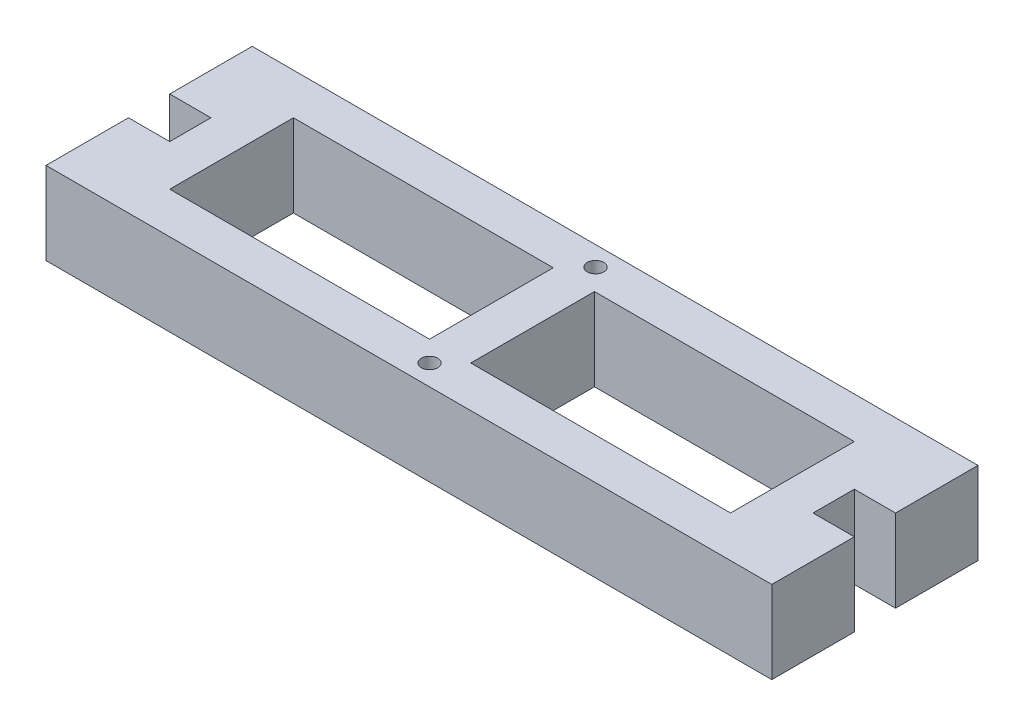
from build123d import *

# Parameters (mm, degrees)
SKETCH1_W           = 98
SKETCH1_H           = 25
BOSS_EXTRUDE1_DEPTH = 10
CUT_EXTRUDE4_DEPTH  = 10
SKETCH4_W           = 25
SKETCH4_H           = 10
CUT_EXTRUDE6_DEPTH  = 5
SKETCH5_W           = 25
SKETCH5_H           = 10
CUT_EXTRUDE7_DEPTH  = 5
SKETCH6_W           = 5
SKETCH6_H           = 10
CUT_EXTRUDE8_DEPTH  = 5
SKETCH7_W           = 5
SKETCH7_H           = 10
CUT_EXTRUDE9_DEPTH  = 5
CUT_EXTRUDE10_DEPTH = 1.5
SKETCH9_R           = 1
CUT_EXTRUDE11_DEPTH = 11.5
SKETCH10_R          = 1
CUT_EXTRUDE12_DEPTH = 19.5
SKETCH11_R          = 1.75
CUT_EXTRUDE13_DEPTH = 1.5


with BuildPart() as part:
    # Sketch1 → Boss-Extrude1 (new body)
    with BuildSketch(Plane(origin=(0, 0, 0), x_dir=(1, 0, 0), z_dir=(0, 1, 0))):
        Rectangle(SKETCH1_W, SKETCH1_H)
    extrude(amount=BOSS_EXTRUDE1_DEPTH)

    # Sketch2 → Cut-Extrude4 (cut)
    with BuildSketch(Plane(origin=(0, 10, 0), x_dir=(1, 0, 0), z_dir=(0, 1, 0))):
        Polygon((-2.5, 2.403992328), (-2.5, -7.5), (-34, -7.5), (-34, 7.5), (-2.5, 7.5), align=None)
        Polygon((2.5, 2.403992328), (2.5, 7.5), (34, 7.5), (34, -7.5), (2.5, -7.5), align=None)
    extrude(amount=-CUT_EXTRUDE4_DEPTH, mode=Mode.SUBTRACT)

    # Sketch4 → Cut-Extrude6 (cut)
    with BuildSketch(Plane.ZY.offset(49)):
        with Locations((0, 5)):
            Rectangle(SKETCH4_W, SKETCH4_H)
    extrude(amount=-CUT_EXTRUDE6_DEPTH, mode=Mode.SUBTRACT)

    # Sketch5 → Cut-Extrude7 (cut)
    with BuildSketch(Plane(origin=(49, 0, 0), x_dir=(0, 0, -1), z_dir=(1, 0, 0))):
        with Locations((0, 5)):
            Rectangle(SKETCH5_W, SKETCH5_H)
    extrude(amount=-CUT_EXTRUDE7_DEPTH, mode=Mode.SUBTRACT)

    # Sketch6 → Cut-Extrude8 (cut)
    with BuildSketch(Plane(origin=(44, 0, 0), x_dir=(0, 0, -1), z_dir=(1, 0, 0))):
        with Locations((0, 5)):
            Rectangle(SKETCH6_W, SKETCH6_H)
    extrude(amount=-CUT_EXTRUDE8_DEPTH, mode=Mode.SUBTRACT)

    # Sketch7 → Cut-Extrude9 (cut)
    with BuildSketch(Plane.ZY.offset(44)):
        with Locations((0, 5)):
            Rectangle(SKETCH7_W, SKETCH7_H)
    extrude(amount=-CUT_EXTRUDE9_DEPTH, mode=Mode.SUBTRACT)

    # Sketch8 → Cut-Extrude10 (cut)
    with BuildSketch(Plane.XZ):
        with BuildLine():
            ThreePointArc((0, 11.75), (-1.75, 10), (0, 8.25))
            Line((0, 8.25), (0, 11.75))
        make_face()
        with BuildLine():
            Line((0, 11.75), (0, 8.25))
            ThreePointArc((0, 8.25), (1.237436867, 8.762563133), (1.75, 10))
            ThreePointArc((1.75, 10), (1.237436867, 11.237436867), (0, 11.75))
        make_face()
    extrude(amount=-CUT_EXTRUDE10_DEPTH, mode=Mode.SUBTRACT)

    # Sketch9 → Cut-Extrude11 (cut)
    with BuildSketch(Plane.XZ.offset(-1.5)):
        with Locations(Location((0, 10, 0), (0, 0, 270))):
            Circle(SKETCH9_R)
    extrude(amount=-CUT_EXTRUDE11_DEPTH, mode=Mode.SUBTRACT)

    # Sketch10 → Cut-Extrude12 (cut)
    with BuildSketch(Plane.XZ):
        with Locations(Location((0, -10.129347353, 0), (0, 0, 270))):
            Circle(SKETCH10_R)
    extrude(amount=-CUT_EXTRUDE12_DEPTH, mode=Mode.SUBTRACT)

    # Sketch11 → Cut-Extrude13 (cut)
    with BuildSketch(Plane.XZ):
        with Locations(Location((0, -10.129347353, 0), (0, 0, 270))):
            Circle(SKETCH11_R)
    extrude(amount=-CUT_EXTRUDE13_DEPTH, mode=Mode.SUBTRACT)


solid = part.part
